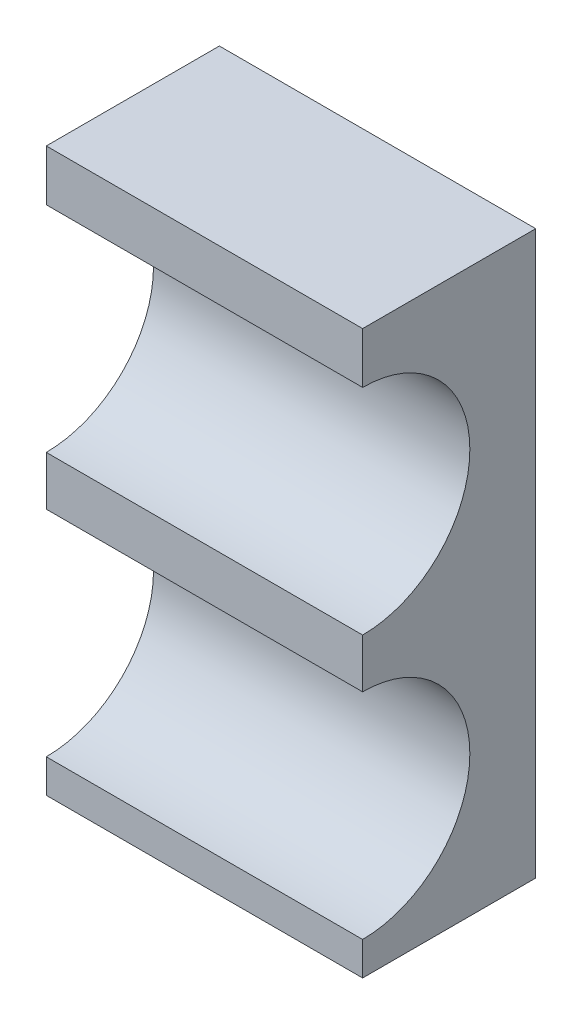
from build123d import *

# Parameters (mm, degrees)
SKETCH1_W           = 9.848024316
SKETCH1_H           = 16
BOSS_EXTRUDE1_DEPTH = 9
SKETCH3_R           = 3.05
CUT_EXTRUDE1_DEPTH  = 9
SKETCH4_W           = 8.110790477
SKETCH4_H           = 20.153934792
CUT_EXTRUDE2_DEPTH  = 9


with BuildPart() as part:
    # Sketch1 → Boss-Extrude1 (new body)
    with BuildSketch(Plane(origin=(0, 0, 0), x_dir=(0, 0, -1), z_dir=(1, 0, 0))):
        Rectangle(SKETCH1_W, SKETCH1_H)
    extrude(amount=BOSS_EXTRUDE1_DEPTH)

    # Sketch3 → Cut-Extrude1 (cut)
    with BuildSketch(Plane.ZY):
        with Locations((0, 3.5)):
            Circle(SKETCH3_R)
        with Locations((0, -4)):
            Circle(SKETCH3_R)
    extrude(amount=-CUT_EXTRUDE1_DEPTH, mode=Mode.SUBTRACT)

    # Sketch4 → Cut-Extrude2 (cut)
    with BuildSketch(Plane.ZY):
        with Locations((4.055395239, 0)):
            Rectangle(SKETCH4_W, SKETCH4_H)
    extrude(amount=-CUT_EXTRUDE2_DEPTH, mode=Mode.SUBTRACT)


solid = part.part
